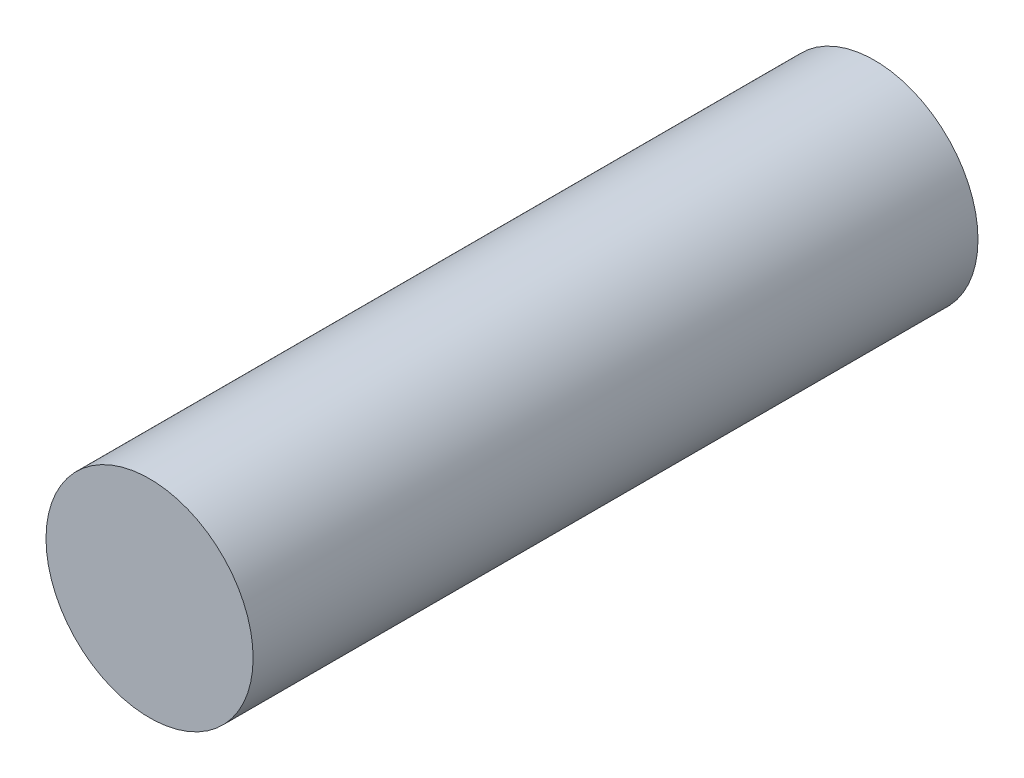
from build123d import *

# Parameters (mm, degrees)
SKETCH1_R           = 3.175
BOSS_EXTRUDE1_DEPTH = 11.1125


with BuildPart() as part:
    # Sketch1 → Boss-Extrude1 (new, symmetric)
    with BuildSketch(Plane.XY):
        Circle(SKETCH1_R)
    extrude(amount=BOSS_EXTRUDE1_DEPTH, both=True)


solid = part.part
